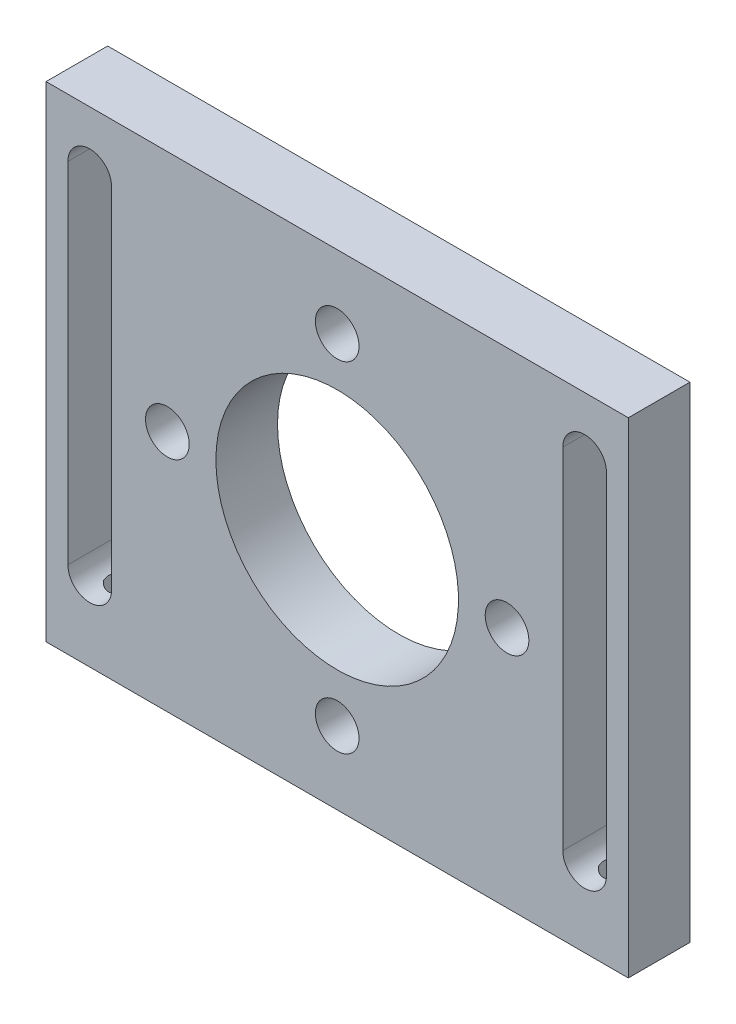
from build123d import *

# Parameters (mm, degrees)
SKETCH1_W                                       = 60
SKETCH1_H                                       = 50
BOSS_EXTRUDE1_DEPTH                             = 6.35
CUT_EXTRUDE1_DEPTH                              = 40.564156758
HOLE1_D                                         = 25
CSK_FOR_M4_FLAT_HEAD_MACHINE_SCREW1_D           = 4.5
CSK_FOR_M4_FLAT_HEAD_MACHINE_SCREW1_CSINK_D     = 9.4
CSK_FOR_M4_FLAT_HEAD_MACHINE_SCREW1_CSINK_ANGLE = 90
M3X0_5_TAPPED_HOLE1_D                           = 2.5
M3X0_5_TAPPED_HOLE1_DEPTH                       = 6
M3X0_5_TAPPED_HOLE1_TIP                         = 0.751075774


with BuildPart() as part:
    # Sketch1 → Boss-Extrude1 (new body)
    with BuildSketch(Plane(origin=(0, 0, 0), x_dir=(-1, 0, 0), z_dir=(0, 0, -1))):
        Rectangle(SKETCH1_W, SKETCH1_H)
    extrude(amount=-BOSS_EXTRUDE1_DEPTH)

    # Sketch2 → Cut-Extrude1 (cut, through all)
    with BuildSketch(Plane(origin=(0, 0, 0), x_dir=(-1, 0, 0), z_dir=(0, 0, -1))):
        with BuildLine():
            Line((27.75, -17), (27.75, 19))
            ThreePointArc((27.75, 19), (25.5, 21.25), (23.25, 19))
            Line((23.25, 19), (23.25, -17))
            ThreePointArc((23.25, -17), (25.5, -19.25), (27.75, -17))
        make_face()
    cut_extrude1 = extrude(amount=-CUT_EXTRUDE1_DEPTH, mode=Mode.SUBTRACT)

    # Hole1 (through all)
    with Locations(Plane(origin=(0, 0, 0), x_dir=(-1, 0, 0), z_dir=(0, 0, -1))):
        with Locations((0, 0)):
            Hole(HOLE1_D / 2)

    # CSK for M4 Flat Head Machine Screw1 (through all)
    with Locations(Plane(origin=(0, 0, 0), x_dir=(-1, 0, 0), z_dir=(0, 0, -1))):
        with Locations((0, 17.5), (17.5, 0), (0, -17.5), (-17.5, 0)):
            CounterSinkHole(CSK_FOR_M4_FLAT_HEAD_MACHINE_SCREW1_D / 2, CSK_FOR_M4_FLAT_HEAD_MACHINE_SCREW1_CSINK_D / 2, counter_sink_angle=CSK_FOR_M4_FLAT_HEAD_MACHINE_SCREW1_CSINK_ANGLE)

    # M3x0.5 Tapped Hole1
    with Locations(Plane(origin=(0, -25, 0), x_dir=(-1, 0, 0), z_dir=(0, -1, 0))):
        with Locations((-25.5, -3.175), (25.5, -3.175)):
            Hole(M3X0_5_TAPPED_HOLE1_D / 2, depth=M3X0_5_TAPPED_HOLE1_DEPTH)
            with Locations((0, 0, -(M3X0_5_TAPPED_HOLE1_DEPTH + M3X0_5_TAPPED_HOLE1_TIP / 2))):  # 118° drill point
                Cone(0, M3X0_5_TAPPED_HOLE1_D / 2, M3X0_5_TAPPED_HOLE1_TIP, mode=Mode.SUBTRACT)

    # Mirror2: Cut-Extrude1 across plane
    add(cut_extrude1.mirror(Plane(origin=(0, 0, 0), x_dir=(0, 0, 1), z_dir=(1, 0, 0))), mode=Mode.SUBTRACT)


solid = part.part
